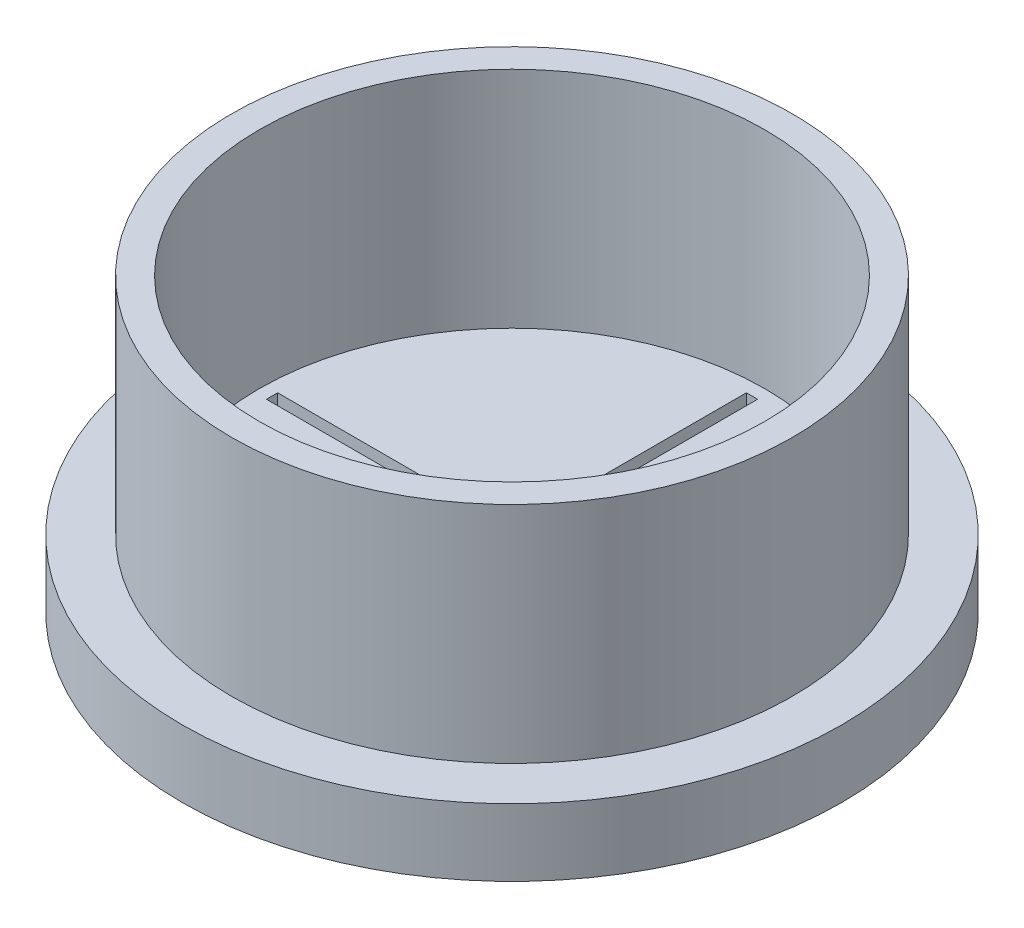
from build123d import *

# Parameters (mm, degrees)
SKETCH1_R           = 14.7
BOSS_EXTRUDE1_DEPTH = 3
SKETCH3_W           = 21.4
SKETCH3_H           = 0.5
CUT_EXTRUDE1_DEPTH  = 3
SKETCH4_W           = 0.5
SKETCH4_H           = 21.4
CUT_EXTRUDE2_DEPTH  = 3
SKETCH5_R           = 12.5
BOSS_EXTRUDE3_DEPTH = 10
SKETCH6_R           = 11.27
CUT_EXTRUDE3_DEPTH  = 10


with BuildPart() as part:
    # Sketch1 → Boss-Extrude1 (new body)
    with BuildSketch(Plane(origin=(0, 0, 0), x_dir=(1, 0, 0), z_dir=(0, 1, 0))):
        with Locations(Location((0, 0, 0), (0, 0, 270))):
            Circle(SKETCH1_R)
    extrude(amount=BOSS_EXTRUDE1_DEPTH)

    # Sketch3 → Cut-Extrude1 (cut)
    with BuildSketch(Plane(origin=(0, 3, 0), x_dir=(1, 0, 0), z_dir=(0, 1, 0))):
        Rectangle(SKETCH3_W, SKETCH3_H)
    extrude(amount=-CUT_EXTRUDE1_DEPTH, mode=Mode.SUBTRACT)

    # Sketch4 → Cut-Extrude2 (cut)
    with BuildSketch(Plane(origin=(0, 3, 0), x_dir=(1, 0, 0), z_dir=(0, 1, 0))):
        Rectangle(SKETCH4_W, SKETCH4_H)
    extrude(amount=-CUT_EXTRUDE2_DEPTH, mode=Mode.SUBTRACT)

    # Sketch5 → Boss-Extrude3 (add)
    with BuildSketch(Plane(origin=(0, 3, 0), x_dir=(1, 0, 0), z_dir=(0, 1, 0))):
        with Locations(Location((0, 0, 0), (0, 0, 270))):
            Circle(SKETCH5_R)
    extrude(amount=BOSS_EXTRUDE3_DEPTH)

    # Sketch6 → Cut-Extrude3 (cut)
    with BuildSketch(Plane(origin=(0, 13, 0), x_dir=(1, 0, 0), z_dir=(0, 1, 0))):
        with Locations(Location((0, 0, 0), (0, 0, 270))):
            Circle(SKETCH6_R)
    extrude(amount=-CUT_EXTRUDE3_DEPTH, mode=Mode.SUBTRACT)


solid = part.part
